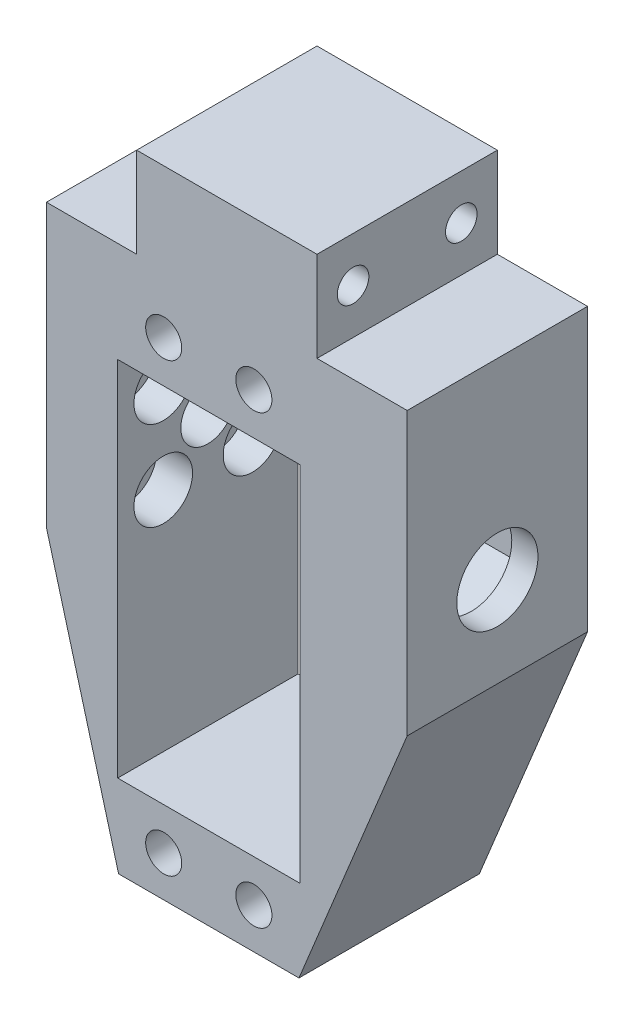
from build123d import *

# Parameters (mm, degrees)
SKETCH1_W                                           = 40
SKETCH1_H                                           = 70.5
BOSS_EXTRUDE1_DEPTH                                 = 20
SKETCH2_W                                           = 20.2
SKETCH2_H                                           = 40.2
CUT_EXTRUDE1_DEPTH                                  = 30
CBORE_FOR_M3_HEX_SOCKET_HEAD_CAP_SCREW1_D           = 3.2
CBORE_FOR_M3_HEX_SOCKET_HEAD_CAP_SCREW1_DEPTH       = 7.9
CBORE_FOR_M3_HEX_SOCKET_HEAD_CAP_SCREW1_CBORE_D     = 6.5
CBORE_FOR_M3_HEX_SOCKET_HEAD_CAP_SCREW1_CBORE_DEPTH = 4
CUT_EXTRUDE2_DEPTH                                  = 9
SKETCH8_R                                           = 4.5
CUT_EXTRUDE3_DEPTH                                  = 58.593163657
CUT_EXTRUDE4_DEPTH                                  = 50.239846669
CUT_EXTRUDE4_DEPTH_BACK                             = 50.239846669
SKETCH12_R                                          = 2
CUT_EXTRUDE5_DEPTH                                  = 50.239846669
CUT_EXTRUDE6_DEPTH                                  = 16
SKETCH15_W                                          = 10
SKETCH15_H                                          = 10
CUT_EXTRUDE7_DEPTH                                  = 50.239846669
SKETCH16_R                                          = 1.75
CUT_EXTRUDE8_DEPTH                                  = 54.296927679
CUT_EXTRUDE9_REACH                                  = 61.503
SKETCH17_R                                          = 3


with BuildPart() as part:
    # Sketch1 → Boss-Extrude1 (new body)
    with BuildSketch(Plane.XY):
        with Locations((2, -4)):
            Rectangle(SKETCH1_W, SKETCH1_H)
    extrude(amount=-BOSS_EXTRUDE1_DEPTH)

    # Sketch2 → Cut-Extrude1 (cut)
    with BuildSketch(Plane.XY):
        with Locations((0, -10)):
            Rectangle(SKETCH2_W, SKETCH2_H)
    extrude(amount=-CUT_EXTRUDE1_DEPTH, mode=Mode.SUBTRACT)

    # CBORE for M3 Hex Socket Head Cap Screw1
    with Locations(Plane(origin=(-10.1, 0, 0), x_dir=(0, 0, -1), z_dir=(1, 0, 0))):
        with Locations((5.050252532, 4.949747468), (14.949747468, 4.949747468), (14.949747468, -4.949747468), (5.050252532, -4.949747468)):
            CounterBoreHole(CBORE_FOR_M3_HEX_SOCKET_HEAD_CAP_SCREW1_D / 2, CBORE_FOR_M3_HEX_SOCKET_HEAD_CAP_SCREW1_CBORE_D / 2, CBORE_FOR_M3_HEX_SOCKET_HEAD_CAP_SCREW1_CBORE_DEPTH, depth=CBORE_FOR_M3_HEX_SOCKET_HEAD_CAP_SCREW1_DEPTH)

    # Sketch7 → Cut-Extrude2 (cut)
    with BuildSketch(Plane.ZY.offset(-10.1)):
        Polygon((-10, 7.794228634), (-16.75, 3.897114317), (-16.75, -3.897114317), (-10, -7.794228634), (-3.25, -3.897114317), (-3.25, 3.897114317), align=None)
    extrude(amount=-CUT_EXTRUDE2_DEPTH, mode=Mode.SUBTRACT)

    # Sketch8 → Cut-Extrude3 (cut, through all)
    with BuildSketch(Plane.ZY.offset(-19.1)):
        with Locations(Location((-10, 0, 0), (0, 0, 270))):
            Circle(SKETCH8_R)
    extrude(amount=-CUT_EXTRUDE3_DEPTH, mode=Mode.SUBTRACT)

    # Sketch9 → Cut-Extrude4 (cut, two sides: drawn at the far end of the back side and taken through both)
    with BuildSketch(Plane.XY.offset(-CUT_EXTRUDE4_DEPTH_BACK)):
        Polygon((-18, -10), (-10, -39.25), (-18, -39.25), align=None)
        Polygon((10, -39.25), (22, -10), (22, -39.25), align=None)
    extrude(amount=CUT_EXTRUDE4_DEPTH + CUT_EXTRUDE4_DEPTH_BACK, mode=Mode.SUBTRACT)

    # Sketch12 → Cut-Extrude5 (cut, through all)
    with BuildSketch(Plane.XY):
        with Locations((-5, -34.75)):
            Circle(SKETCH12_R)
        with Locations((5, -34.75)):
            Circle(SKETCH12_R)
        with Locations((5, 14.75)):
            Circle(SKETCH12_R)
        with Locations((-5, 14.75)):
            Circle(SKETCH12_R)
    extrude(amount=-CUT_EXTRUDE5_DEPTH, mode=Mode.SUBTRACT)

    # Sketch13 → Cut-Extrude6 (cut)
    with BuildSketch(Plane(origin=(0, 0, -20), x_dir=(-1, 0, 0), z_dir=(0, 0, -1))):
        Polygon((-1.535898385, 14.75), (-3.267949192, 17.75), (-6.732050808, 17.75), (-8.464101615, 14.75), (-6.732050808, 11.75), (-3.267949192, 11.75), align=None)
        Polygon((3.267949192, 17.75), (1.535898385, 14.75), (3.267949192, 11.75), (6.732050808, 11.75), (8.464101615, 14.75), (6.732050808, 17.75), align=None)
        Polygon((-6.732050808, -31.75), (-8.464101615, -34.75), (-6.732050808, -37.75), (-3.267949192, -37.75), (-1.535898385, -34.75), (-3.267949192, -31.75), align=None)
        Polygon((3.267949192, -31.75), (1.535898385, -34.75), (3.267949192, -37.75), (6.732050808, -37.75), (8.464101615, -34.75), (6.732050808, -31.75), align=None)
    extrude(amount=-CUT_EXTRUDE6_DEPTH, mode=Mode.SUBTRACT)

    # Sketch15 → Cut-Extrude7 (cut, through all)
    with BuildSketch(Plane.XY):
        with Locations((-13, 26.25)):
            Rectangle(SKETCH15_W, SKETCH15_H)
        with Locations((17, 26.25)):
            Rectangle(SKETCH15_W, SKETCH15_H)
    extrude(amount=-CUT_EXTRUDE7_DEPTH, mode=Mode.SUBTRACT)

    # Sketch16 → Cut-Extrude8 (cut, through all)
    with BuildSketch(Plane.ZY.offset(8)):
        with Locations((-16, 26.25)):
            Circle(SKETCH16_R)
        with Locations((-4, 26.25)):
            Circle(SKETCH16_R)
    extrude(amount=-CUT_EXTRUDE8_DEPTH, mode=Mode.SUBTRACT)

    # Sketch17 → Cut-Extrude9 (cut, up to next)
    with BuildSketch(Plane.ZY.offset(18), mode=Mode.PRIVATE) as cut_extrude9_sk1:
        with Locations(Location((-10, 0, 0), (0, 0, 270))):
            Circle(SKETCH17_R)
    cut_extrude9_tool1 = extrude(cut_extrude9_sk1.sketch, amount=-CUT_EXTRUDE9_REACH, mode=Mode.PRIVATE) & part.part
    add(cut_extrude9_tool1.solids().sort_by_distance((-18, 0, -10))[0], mode=Mode.SUBTRACT)


solid = part.part
